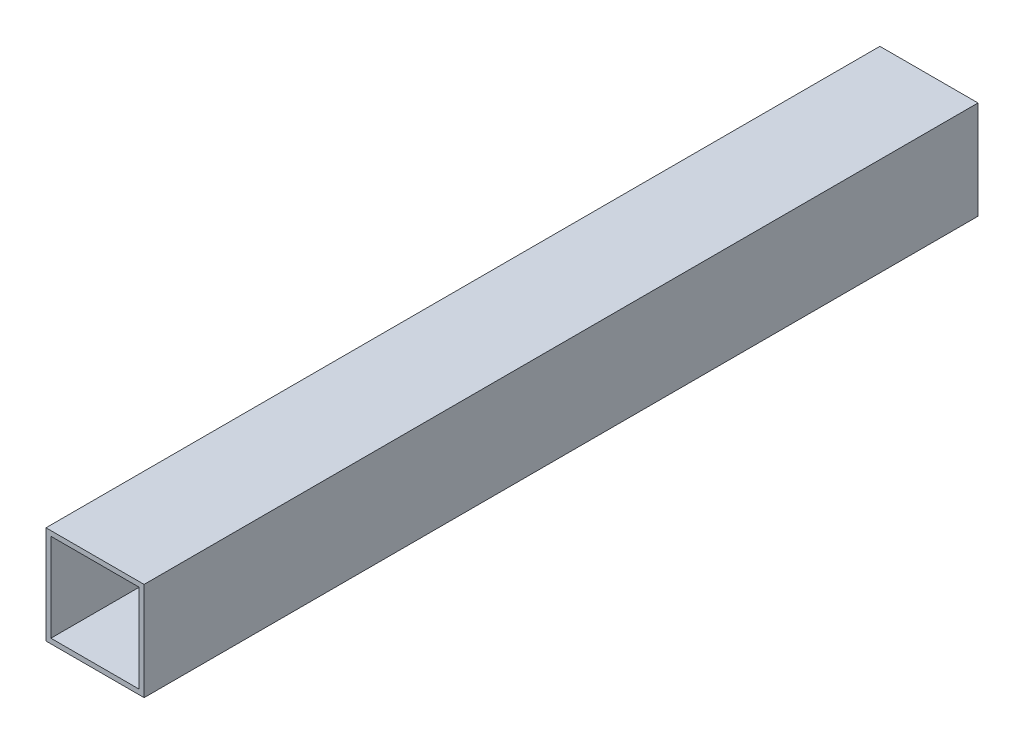
from build123d import *

# Parameters (mm, degrees)
CROQUIS1_W            = 40
CROQUIS1_H            = 40
CROQUIS1_W_2          = 36
CROQUIS1_H_2          = 36
EXTRUIR_L_MINA1_DEPTH = 340


with BuildPart() as part:
    # Croquis1 → Extruir-Lámina1 (new body)
    with BuildSketch(Plane.XY):
        Rectangle(CROQUIS1_W, CROQUIS1_H)
        Rectangle(CROQUIS1_W_2, CROQUIS1_H_2, mode=Mode.SUBTRACT)
    extrude(amount=EXTRUIR_L_MINA1_DEPTH)


solid = part.part
